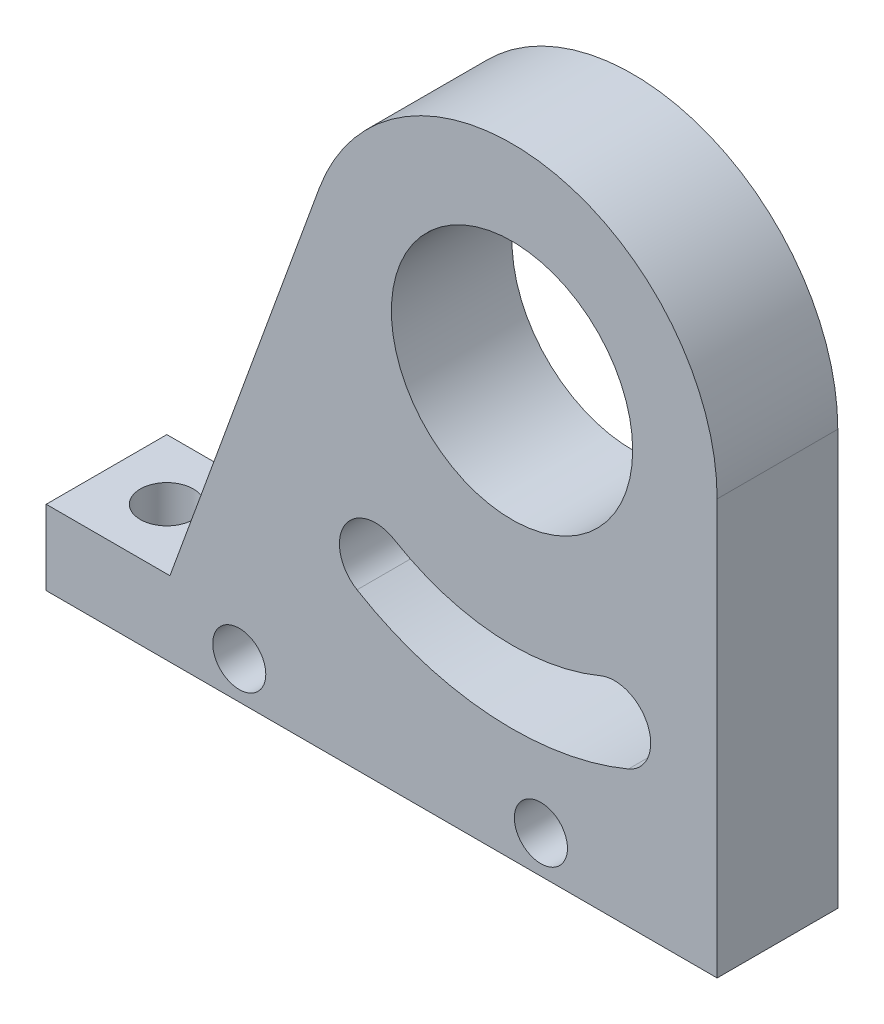
from build123d import *

# Parameters (mm, degrees)
SKETCH1_R           = 10
EXTRUDE_3_8_DEPTH   = 10
CUT_EXTRUDE2_DEPTH  = 10
BOSS_EXTRUDE2_DEPTH = 10
SKETCH5_R           = 2.2
M5_DRILL_DEPTH      = 8
SKETCH7_R           = 2.2
M4_THROUGH2_DEPTH   = 10


with BuildPart() as part:
    # Sketch1 → 3/8 (new body)
    with BuildSketch(Plane.XY):
        with BuildLine():
            Line((17, 0), (17, -34.388204953))
            Line((17, -34.388204953), (-30.607305145, -34.388204953))
            Line((-30.607305145, -34.388204953), (-15.974774553, 5.814342437))
            ThreePointArc((-15.974774553, 5.814342437), (2.95201902, 16.741731801), (17, 0))
        make_face()
        Circle(SKETCH1_R, mode=Mode.SUBTRACT)
    extrude(amount=EXTRUDE_3_8_DEPTH)

    # Sketch4 → Cut-Extrude2 (cut)
    with BuildSketch(Plane.XY.offset(10)):
        with BuildLine():
            ThreePointArc((-9.762664623, -16.30001164), (-1.360957212, -18.951195093), (7.333365278, -17.527742402))
            ThreePointArc((7.333365278, -17.527742402), (11.258803332, -19.137380895), (9.649164839, -23.06281895))
            ThreePointArc((9.649164839, -23.06281895), (-1.790733174, -24.935783018), (-12.845611346, -21.447383737))
            ThreePointArc((-12.845611346, -21.447383737), (-13.877824033, -17.332224327), (-9.762664623, -16.30001164))
        make_face()
    extrude(amount=-CUT_EXTRUDE2_DEPTH, mode=Mode.SUBTRACT)

    # Sketch6 → Boss-Extrude2 (add)
    with BuildSketch(Plane.XY.offset(10)):
        Polygon((-30.607305145, -34.388204953), (-38.607305145, -34.388204953), (-38.607305145, -28.188204953), (-28.350689692, -28.188204953), align=None)
    extrude(amount=-BOSS_EXTRUDE2_DEPTH)

    # Sketch5 → M5_DRILL (cut)
    with BuildSketch(Plane.XZ.offset(34.388204953)):
        with Locations((-33.607305145, 5)):
            Circle(SKETCH5_R)
        with Locations((-8.607305145, 5)):
            Circle(SKETCH5_R)
    extrude(amount=-M5_DRILL_DEPTH, mode=Mode.SUBTRACT)

    # Sketch7 → M4_through2 (cut)
    with BuildSketch(Plane.XY.offset(10)):
        with Locations((-22.607305145, -31.288204953)):
            Circle(SKETCH7_R)
        with Locations((2.392694855, -31.288204953)):
            Circle(SKETCH7_R)
    extrude(amount=-M4_THROUGH2_DEPTH, mode=Mode.SUBTRACT)


solid = part.part
